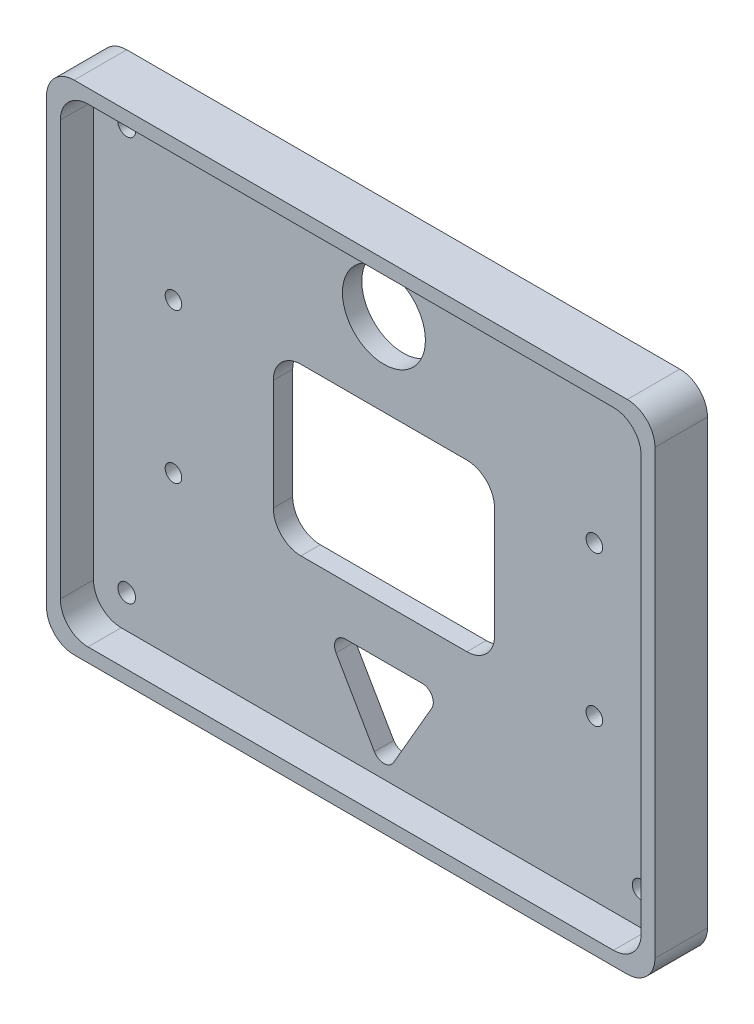
from build123d import *

# Parameters (mm, degrees)
SKETCH1_R           = 1.6
SKETCH1_R_2         = 1.5
BOSS_EXTRUDE1_DEPTH = 3.5
SKETCH2_R           = 7.5
CUT_EXTRUDE1_DEPTH  = 10
BOSS_EXTRUDE2_DEPTH = 6
CUT_EXTRUDE2_DEPTH  = 6


with BuildPart() as part:
    # Sketch1 → Boss-Extrude1 (new body)
    with BuildSketch(Plane.XY):
        with BuildLine():
            Line((50, -45), (-50, -45))
            ThreePointArc((-50, -45), (-53.535533906, -43.535533906), (-55, -40))
            Line((-55, -40), (-55, 40))
            ThreePointArc((-55, 40), (-53.535533906, 43.535533906), (-50, 45))
            Line((-50, 45), (50, 45))
            ThreePointArc((50, 45), (53.535533906, 43.535533906), (55, 40))
            Line((55, 40), (55, -40))
            ThreePointArc((55, -40), (53.535533906, -43.535533906), (50, -45))
        make_face()
        with Locations((-46.5, 36.5)):
            Circle(SKETCH1_R, mode=Mode.SUBTRACT)
        with Locations((46.5, 36.5)):
            Circle(SKETCH1_R, mode=Mode.SUBTRACT)
        with Locations(Location((46.5, -36.5, 0), (0, 0, 180))):
            Circle(SKETCH1_R, mode=Mode.SUBTRACT)
        with Locations(Location((-46.5, -36.5, 0), (0, 0, 180))):
            Circle(SKETCH1_R, mode=Mode.SUBTRACT)
        with Locations((38.05, 13.55)):
            Circle(SKETCH1_R_2, mode=Mode.SUBTRACT)
        with Locations((38.05, -13.55)):
            Circle(SKETCH1_R_2, mode=Mode.SUBTRACT)
        with Locations(Location((-38.05, -13.55, 0), (0, 0, 180))):
            Circle(SKETCH1_R_2, mode=Mode.SUBTRACT)
        with Locations(Location((-38.05, 13.55, 0), (0, 0, 180))):
            Circle(SKETCH1_R_2, mode=Mode.SUBTRACT)
    extrude(amount=BOSS_EXTRUDE1_DEPTH)

    # Sketch2 → Cut-Extrude1 (cut)
    with BuildSketch(Plane(origin=(0, 0, 0), x_dir=(-1, 0, 0), z_dir=(0, 0, -1))):
        with Locations((0, 30)):
            Circle(SKETCH2_R)
        with BuildLine():
            Line((-15, -15), (15, -15))
            ThreePointArc((15, -15), (18.535533906, -13.535533906), (20, -10))
            Line((20, -10), (20, 10))
            ThreePointArc((20, 10), (18.535533906, 13.535533906), (15, 15))
            Line((15, 15), (-15, 15))
            ThreePointArc((-15, 15), (-18.535533906, 13.535533906), (-20, 10))
            Line((-20, 10), (-20, -10))
            ThreePointArc((-20, -10), (-18.535533906, -13.535533906), (-15, -15))
        make_face()
        with BuildLine():
            Line((1.732050808, -39), (8.660254038, -27))
            ThreePointArc((8.660254038, -27), (8.660254038, -25), (6.92820323, -24))
            Line((6.92820323, -24), (-6.92820323, -24))
            ThreePointArc((-6.92820323, -24), (-8.660254038, -25), (-8.660254038, -27))
            Line((-8.660254038, -27), (-1.732050808, -39))
            ThreePointArc((-1.732050808, -39), (0, -40), (1.732050808, -39))
        make_face()
    extrude(amount=-CUT_EXTRUDE1_DEPTH, mode=Mode.SUBTRACT)

    # Sketch3 → Boss-Extrude2 (add)
    with BuildSketch(Plane.XY.offset(3.5)):
        with BuildLine():
            Line((50, -45), (-50, -45))
            ThreePointArc((-50, -45), (-53.535533906, -43.535533906), (-55, -40))
            Line((-55, -40), (-55, 40))
            ThreePointArc((-55, 40), (-53.535533906, 43.535533906), (-50, 45))
            Line((-50, 45), (50, 45))
            ThreePointArc((50, 45), (53.535533906, 43.535533906), (55, 40))
            Line((55, 40), (55, -40))
            ThreePointArc((55, -40), (53.535533906, -43.535533906), (50, -45))
        make_face()
    extrude(amount=BOSS_EXTRUDE2_DEPTH)

    # Sketch4 → Cut-Extrude2 (cut)
    with BuildSketch(Plane.XY.offset(9.5)):
        with BuildLine():
            Line((47.5, -42.5), (-47.5, -42.5))
            ThreePointArc((-47.5, -42.5), (-51.035533906, -41.035533906), (-52.5, -37.5))
            Line((-52.5, -37.5), (-52.5, 37.5))
            ThreePointArc((-52.5, 37.5), (-51.035533906, 41.035533906), (-47.5, 42.5))
            Line((-47.5, 42.5), (47.5, 42.5))
            ThreePointArc((47.5, 42.5), (51.035533906, 41.035533906), (52.5, 37.5))
            Line((52.5, 37.5), (52.5, -37.5))
            ThreePointArc((52.5, -37.5), (51.035533906, -41.035533906), (47.5, -42.5))
        make_face()
    extrude(amount=-CUT_EXTRUDE2_DEPTH, mode=Mode.SUBTRACT)


solid = part.part
